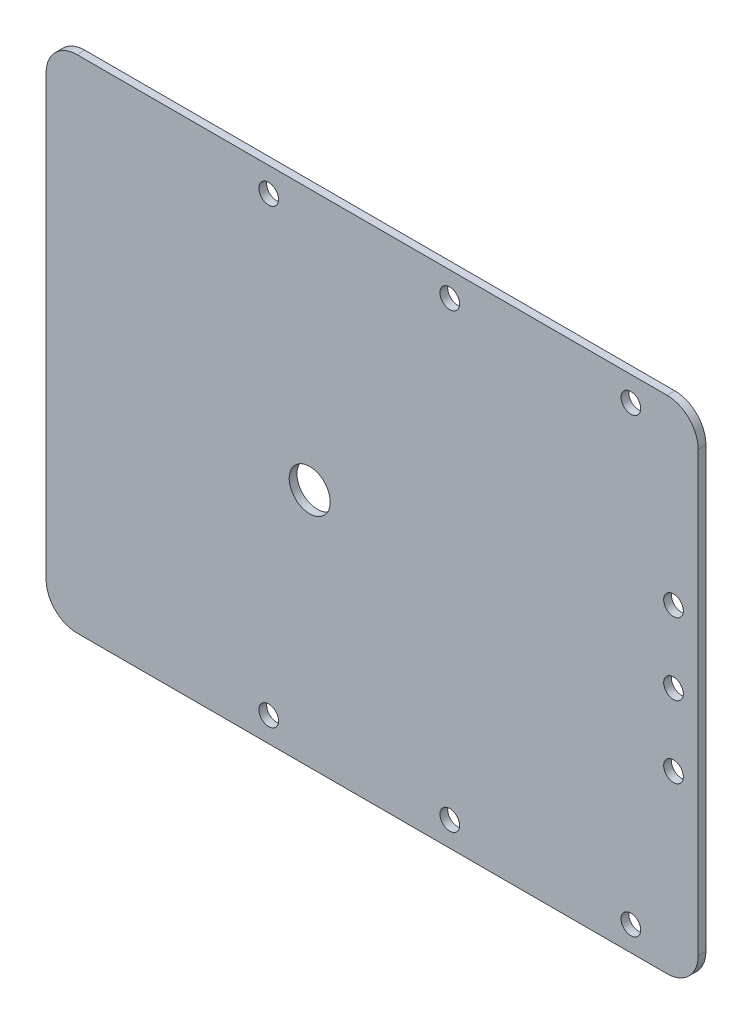
from build123d import *

# Parameters (mm, degrees)
SKETCH1_W               = 126.025
SKETCH1_H               = 96.825
BOSS_EXTRUDE1_DEPTH     = 1.5
F_6_CLEARANCE_HOLE1_D   = 3.7973
SIDEPANEL_PATTERN_COUNT = 3
SIDEPANEL_PATTERN_PITCH = 35
MIRROR1_COPY_1_D        = 3.7973
MIRROR1_COPY_2_D        = 3.7973
F_6_CLEARANCE_HOLE2_D   = 3.7973
LPATTERN2_COUNT         = 3
LPATTERN2_PITCH         = 13.8875
FILLET1_R               = 6
SKETCH9_R               = 3.9624
CUT_EXTRUDE1_DEPTH      = 109.41962749


with BuildPart() as part:
    # Sketch1 → Boss-Extrude1 (new body)
    with BuildSketch(Plane.XY):
        with Locations((1.2625, -38.8875)):
            Rectangle(SKETCH1_W, SKETCH1_H)
    extrude(amount=BOSS_EXTRUDE1_DEPTH)

    # #6 Clearance Hole1 (through all)
    with Locations(Plane.XY.offset(1.5)):
        with Locations((51.275, 4.7625)):
            f_6_clearance_hole1 = Hole(F_6_CLEARANCE_HOLE1_D / 2)

    # Sidepanel Pattern: #6 Clearance Hole1 ×3
    with Locations(*[(-i * SIDEPANEL_PATTERN_PITCH, 0, 0) for i in range(1, SIDEPANEL_PATTERN_COUNT)]):
        add(f_6_clearance_hole1, mode=Mode.SUBTRACT)

    # Mirror1: #6 Clearance Hole1 across plane
    add(f_6_clearance_hole1.mirror(Plane.ZX.offset(-38.8875)), mode=Mode.SUBTRACT)

    # Mirror1 copy 1 (through all)
    with Locations(Plane(origin=(-35, -77.775, 1.5), x_dir=(1, 0, 0), z_dir=(0, 0, 1))):
        with Locations((51.275, -4.7625)):
            Hole(MIRROR1_COPY_1_D / 2)

    # Mirror1 copy 2 (through all)
    with Locations(Plane(origin=(-70, -77.775, 1.5), x_dir=(1, 0, 0), z_dir=(0, 0, 1))):
        with Locations((51.275, -4.7625)):
            Hole(MIRROR1_COPY_2_D / 2)

    # #6 Clearance Hole2 (through all)
    with Locations(Plane.XY.offset(1.5)):
        with Locations((59.5125, -25)):
            f_6_clearance_hole2 = Hole(F_6_CLEARANCE_HOLE2_D / 2)

    # LPattern2: #6 Clearance Hole2 ×3
    with Locations(*[(0, -i * LPATTERN2_PITCH, 0) for i in range(1, LPATTERN2_COUNT)]):
        add(f_6_clearance_hole2, mode=Mode.SUBTRACT)

    # Fillet1
    fillet1_edges = [part.edges().sort_by_distance(p)[0] for p in [
        (-61.75, 9.525, 0.75),
        (64.275, 9.525, 0.75),
        (64.275, -87.3, 0.75),
        (-61.75, -87.3, 0.75),
    ]]
    fillet(fillet1_edges, radius=FILLET1_R)

    # Sketch9 → Cut-Extrude1 (cut, through all)
    with BuildSketch(Plane.XY.offset(1.5)):
        with Locations((-10.800946897, -40.88752178)):
            Circle(SKETCH9_R)
    extrude(amount=-CUT_EXTRUDE1_DEPTH, mode=Mode.SUBTRACT)


solid = part.part
